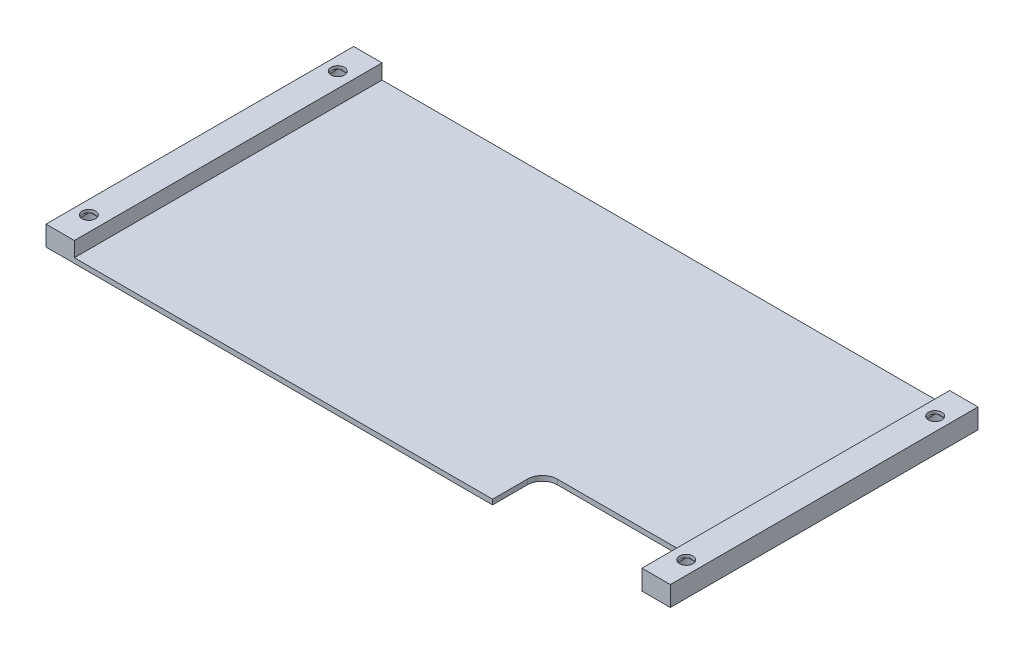
from build123d import *
from build123d.topology import SkipClean

# Parameters (mm, degrees)
SKETCH1_W           = 126
SKETCH1_H           = 61.8
BOSS_EXTRUDE1_DEPTH = 1
SKETCH2_W           = 6
SKETCH2_H           = 61.8
BOSS_EXTRUDE2_DEPTH = 3
SKETCH3_R           = 1.35
CUT_EXTRUDE1_DEPTH  = 71.283781913
SKETCH4_R           = 2.5
CUT_EXTRUDE2_DEPTH  = 3
SKETCH5_W           = 30
SKETCH5_H           = 10
CUT_EXTRUDE3_DEPTH  = 71.283781913
FILLET1_R           = 3
CUT_EXTRUDE4_DEPTH  = 0.2
SKETCH7_W           = 2.7
SKETCH7_H           = 2.7
CUT_EXTRUDE5_DEPTH  = 0.2
SKETCH8_W           = 0.3
SKETCH8_H           = 61.8
CUT_EXTRUDE6_DEPTH  = 71.283781913


with BuildPart() as part:
    # Sketch1 → Boss-Extrude1 (new body)
    with BuildSketch(Plane(origin=(0, 0, 0), x_dir=(1, 0, 0), z_dir=(0, 1, 0))):
        Rectangle(SKETCH1_W, SKETCH1_H)
    extrude(amount=BOSS_EXTRUDE1_DEPTH)

    # Sketch2 → Boss-Extrude2 (add)
    with BuildSketch(Plane(origin=(0, 1, 0), x_dir=(1, 0, 0), z_dir=(0, 1, 0))):
        with Locations((-60, 0)):
            Rectangle(SKETCH2_W, SKETCH2_H)
        with Locations((60, 0)):
            Rectangle(SKETCH2_W, SKETCH2_H)
    extrude(amount=BOSS_EXTRUDE2_DEPTH)

    # Sketch3 → Cut-Extrude1 (cut, through all)
    with BuildSketch(Plane(origin=(0, 4, 0), x_dir=(1, 0, 0), z_dir=(0, 1, 0))):
        with Locations(Location((-60, 25, 0), (0, 0, 270))):
            Circle(SKETCH3_R)
        with Locations(Location((-60, -25, 0), (0, 0, 270))):
            Circle(SKETCH3_R)
        with Locations(Location((60, -25, 0), (0, 0, 90))):
            Circle(SKETCH3_R)
        with Locations(Location((60, 25, 0), (0, 0, 90))):
            Circle(SKETCH3_R)
    extrude(amount=-CUT_EXTRUDE1_DEPTH, mode=Mode.SUBTRACT)

    # Sketch4 → Cut-Extrude2 (cut)
    with BuildSketch(Plane.XZ):
        with Locations(Location((60, -25, 0), (0, 0, 270))):
            Circle(SKETCH4_R)
        with Locations(Location((60, 25, 0), (0, 0, 270))):
            Circle(SKETCH4_R)
        with Locations(Location((-60, 25, 0), (0, 0, 270))):
            Circle(SKETCH4_R)
        with Locations(Location((-60, -25, 0), (0, 0, 270))):
            Circle(SKETCH4_R)
    extrude(amount=-CUT_EXTRUDE2_DEPTH, mode=Mode.SUBTRACT)

    # Sketch5 → Cut-Extrude3 (cut, through all)
    with BuildSketch(Plane.XZ):
        with Locations((42, 25.9)):
            Rectangle(SKETCH5_W, SKETCH5_H)
    extrude(amount=-CUT_EXTRUDE3_DEPTH, mode=Mode.SUBTRACT)

    # Fillet1
    fillet1_edges = [part.edges().sort_by_distance(p)[0] for p in [
        (27, 0.5, 20.9),
        (57, 0.5, 20.9),
    ]]
    fillet(fillet1_edges, radius=FILLET1_R)

    # Sketch6 → Cut-Extrude4 (cut)
    with SkipClean():  # the faces are left unmerged after this step: merging them gives an invalid solid
        with BuildSketch(Plane.XZ.offset(-3)):
            with BuildLine():
                Line((-61.35, 22.895837459), (-61.35, 27.104162541))
                ThreePointArc((-61.35, 27.104162541), (-60, 27.5), (-58.65, 27.104162541))
                Line((-58.65, 27.104162541), (-58.65, 22.895837459))
                ThreePointArc((-58.65, 22.895837459), (-60, 22.5), (-61.35, 22.895837459))
            make_face()
            with BuildLine():
                Line((-61.35, -27.104162541), (-61.35, -22.895837459))
                ThreePointArc((-61.35, -22.895837459), (-60, -22.5), (-58.65, -22.895837459))
                Line((-58.65, -22.895837459), (-58.65, -27.104162541))
                ThreePointArc((-58.65, -27.104162541), (-60, -27.5), (-61.35, -27.104162541))
            make_face()
        cut_extrude4 = extrude(amount=-CUT_EXTRUDE4_DEPTH, mode=Mode.SUBTRACT)

    # Sketch7 → Cut-Extrude5 (cut)
    with SkipClean():  # the faces are left unmerged after this step: merging them gives an invalid solid
        with BuildSketch(Plane.XZ.offset(-3.2)):
            with Locations((-60, -25)):
                Rectangle(SKETCH7_W, SKETCH7_H)
            with Locations((-60, 25)):
                Rectangle(SKETCH7_W, SKETCH7_H)
        cut_extrude5 = extrude(amount=-CUT_EXTRUDE5_DEPTH, mode=Mode.SUBTRACT)

    # Mirror1: Cut-Extrude4, Cut-Extrude5 across plane
    with SkipClean():  # the faces are left unmerged after this step: merging them gives an invalid solid
        add(cut_extrude4.mirror(Plane(origin=(0, 0, 0), x_dir=(0, 0, 1), z_dir=(1, 0, 0))), mode=Mode.SUBTRACT)
        add(cut_extrude5.mirror(Plane(origin=(0, 0, 0), x_dir=(0, 0, 1), z_dir=(1, 0, 0))), mode=Mode.SUBTRACT)

    # Sketch8 → Cut-Extrude6 (cut, through all)
    with SkipClean():  # the faces are left unmerged after this step: merging them gives an invalid solid
        with BuildSketch(Plane(origin=(0, 4, 0), x_dir=(1, 0, 0), z_dir=(0, 1, 0))):
            with Locations((-62.85, 0)):
                Rectangle(SKETCH8_W, SKETCH8_H)
            with Locations((62.85, 0)):
                Rectangle(SKETCH8_W, SKETCH8_H)
        extrude(amount=-CUT_EXTRUDE6_DEPTH, mode=Mode.SUBTRACT)


solid = part.part
